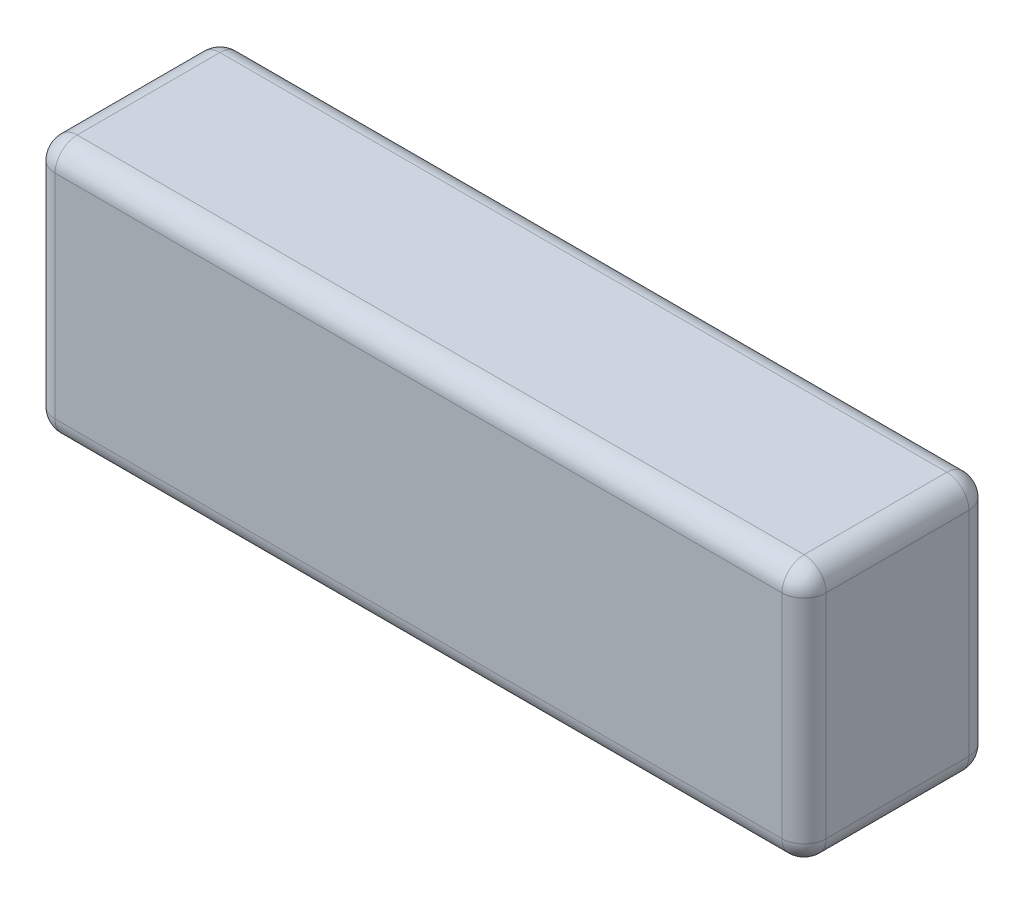
from build123d import *

# Parameters (mm, degrees)
SALIENTE_EXTRUIR1_DEPTH = 12.7
REDONDEO1_R             = 3
REDONDEO2_R             = 3


with BuildPart() as part:
    # Croquis1 → Saliente-Extruir1 (new, symmetric)
    with BuildSketch(Plane.XY):
        with BuildLine():
            Line((-49.3875, 17.4625), (49.3875, 17.4625))
            ThreePointArc((49.3875, 17.4625), (51.508820344, 16.583820344), (52.3875, 14.4625))
            Line((52.3875, 14.4625), (52.3875, -14.4625))
            ThreePointArc((52.3875, -14.4625), (51.508820344, -16.583820344), (49.3875, -17.4625))
            Line((49.3875, -17.4625), (-49.3875, -17.4625))
            ThreePointArc((-49.3875, -17.4625), (-51.508820344, -16.583820344), (-52.3875, -14.4625))
            Line((-52.3875, -14.4625), (-52.3875, 14.4625))
            ThreePointArc((-52.3875, 14.4625), (-51.508820344, 16.583820344), (-49.3875, 17.4625))
        make_face()
    extrude(amount=SALIENTE_EXTRUIR1_DEPTH, both=True)

    # Redondeo1
    redondeo1_edges = [part.edges().sort_by_distance(p)[0] for p in [
        (-51.508820344, 16.583820344, 12.7),
        (-52.3875, 0, 12.7),
        (-51.508820344, -16.583820344, 12.7),
        (0, -17.4625, 12.7),
        (51.508820344, -16.583820344, 12.7),
        (52.3875, 0, 12.7),
        (51.508820344, 16.583820344, 12.7),
        (0, 17.4625, 12.7),
    ]]
    fillet(redondeo1_edges, radius=REDONDEO1_R)

    # Redondeo2
    redondeo2_edges = [part.edges().sort_by_distance(p)[0] for p in [
        (0, 17.4625, -12.7),
        (51.508820344, 16.583820344, -12.7),
        (52.3875, 0, -12.7),
        (51.508820344, -16.583820344, -12.7),
        (0, -17.4625, -12.7),
        (-51.508820344, -16.583820344, -12.7),
        (-52.3875, 0, -12.7),
        (-51.508820344, 16.583820344, -12.7),
    ]]
    fillet(redondeo2_edges, radius=REDONDEO2_R)


solid = part.part
